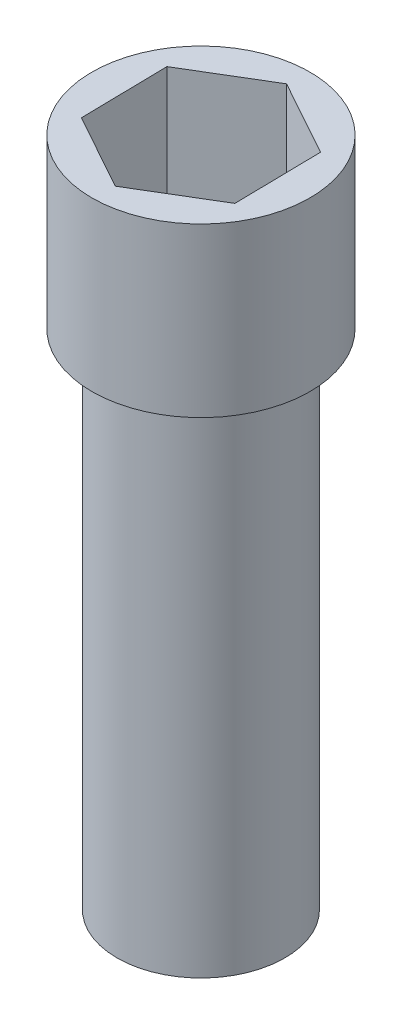
from build123d import *

# Parameters (mm, degrees)
SKETCH1_R           = 5
BOSS_EXTRUDE1_DEPTH = 30
SKETCH2_R           = 6.5
BOSS_EXTRUDE2_DEPTH = 10
CUT_EXTRUDE1_DEPTH  = 9.5


with BuildPart() as part:
    # Sketch1 → Boss-Extrude1 (new body)
    with BuildSketch(Plane(origin=(0, 0, 0), x_dir=(1, 0, 0), z_dir=(0, 1, 0))):
        with Locations(Location((0, 0, 0), (0, 0, 270))):
            Circle(SKETCH1_R)
    extrude(amount=BOSS_EXTRUDE1_DEPTH)

    # Sketch2 → Boss-Extrude2 (add)
    with BuildSketch(Plane(origin=(0, 30, 0), x_dir=(1, 0, 0), z_dir=(0, 1, 0))):
        with Locations(Location((0, 0, 0), (0, 0, 270))):
            Circle(SKETCH2_R)
    extrude(amount=BOSS_EXTRUDE2_DEPTH)

    # Sketch3 → Cut-Extrude1 (cut)
    with BuildSketch(Plane(origin=(0, 40, 0), x_dir=(1, 0, 0), z_dir=(0, 1, 0))):
        Polygon((4.544545679, -2.519346061), (4.454090529, 2.676018976), (-0.09045515, 5.195365037), (-4.544545679, 2.519346061), (-4.454090529, -2.676018976), (0.09045515, -5.195365037), align=None)
    extrude(amount=-CUT_EXTRUDE1_DEPTH, mode=Mode.SUBTRACT)


solid = part.part
